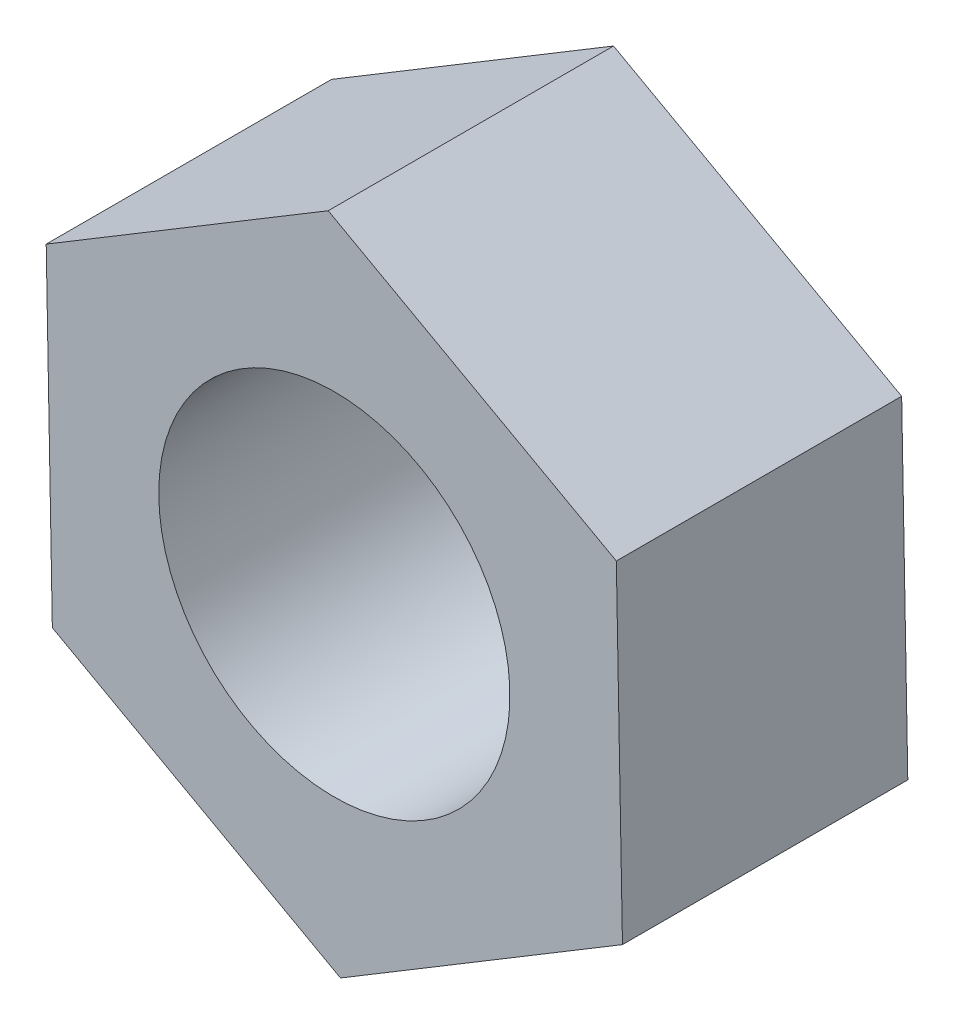
from build123d import *

# Parameters (mm, degrees)
SKETCH1_R           = 4
BOSS_EXTRUDE1_DEPTH = 6.5


with BuildPart() as part:
    # Sketch1 → Boss-Extrude1 (new body)
    with BuildSketch(Plane.XY):
        Polygon((-6.56400294, 3.628204157), (-6.42411844, -3.870491218), (0.1398845, -7.498695375), (6.56400294, -3.628204157), (6.42411844, 3.870491218), (-0.1398845, 7.498695375), align=None)
        with Locations(Location((0, 0, 0), (0, 0, 180))):
            Circle(SKETCH1_R, mode=Mode.SUBTRACT)
    extrude(amount=BOSS_EXTRUDE1_DEPTH)


solid = part.part
